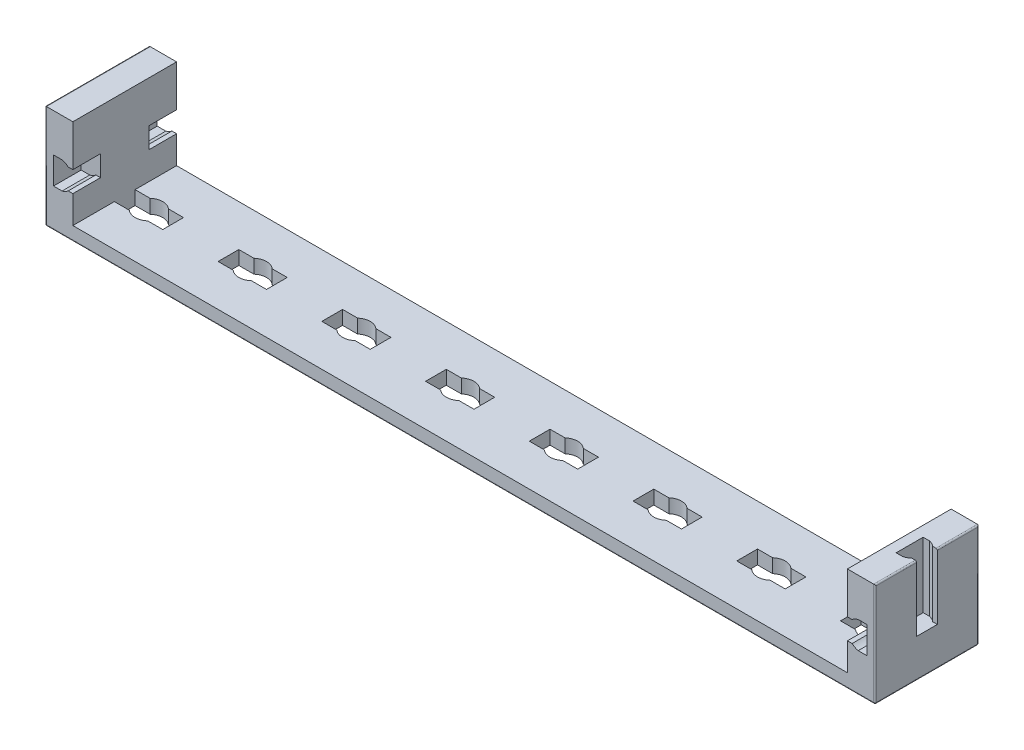
from build123d import *

# Parameters (mm, degrees)
SKETCH_1_W                 = 120
SKETCH_1_H                 = 15
EXTRUDE_1_DEPTH            = 2
SKETCH_2_W                 = 4
SKETCH_2_H                 = 15
EXTRUDE_2_DEPTH            = 13
CUT_EXTRUDE_1_REACH        = 63.849
PATTERN_LINEAR_1_COUNT     = 5
PATTERN_LINEAR_1_PITCH     = 15
PATTERN_LINEAR_1_COL_COUNT = 4
PATTERN_LINEAR_1_COL_PITCH = 15
CUT_EXTRUDE_2_DEPTH        = 4
MIRROR_2_COPY_1_DEPTH      = 4
CUT_EXTRUDE_3_DEPTH        = 9.45
EXTRUDE_3_DEPTH            = 15
CUT_EXTRUDE_4_DEPTH        = 15
FILLET_1_R                 = 0.2
FILLET_2_R                 = 0.1


with BuildPart() as part:
    # 草图1 → 凸台-拉伸1 (new body)
    with BuildSketch(Plane(origin=(0, 0, 0), x_dir=(1, 0, 0), z_dir=(0, 1, 0))):
        Rectangle(SKETCH_1_W, SKETCH_1_H)
    extrude(amount=EXTRUDE_1_DEPTH)

    # 草图2 → 凸台-拉伸2 (add)
    with BuildSketch(Plane(origin=(0, 2, 0), x_dir=(1, 0, 0), z_dir=(0, 1, 0))):
        with Locations((-58, 0)):
            Rectangle(SKETCH_2_W, SKETCH_2_H)
        with Locations((58, 0)):
            Rectangle(SKETCH_2_W, SKETCH_2_H)
    extrude(amount=EXTRUDE_2_DEPTH)

    # 草图3 → 切除-拉伸1 (cut, up to next)
    with BuildSketch(Plane(origin=(0, 2, 0), x_dir=(1, 0, 0), z_dir=(0, 1, 0)), mode=Mode.PRIVATE) as cut_extrude_1_sk1:
        with BuildLine():
            Line((-4, -1.5), (-4, 1.5))
            Line((-4, 1.5), (-6.177124344, 1.5))
            ThreePointArc((-6.177124344, 1.5), (-7.5, 2), (-8.822875656, 1.5))
            Line((-8.822875656, 1.5), (-11, 1.5))
            Line((-11, 1.5), (-11, -1.5))
            Line((-11, -1.5), (-8.822875656, -1.5))
            ThreePointArc((-8.822875656, -1.5), (-7.5, -2), (-6.177124344, -1.5))
            Line((-6.177124344, -1.5), (-4, -1.5))
        make_face()
    cut_extrude_1_tool1 = extrude(cut_extrude_1_sk1.sketch, amount=-CUT_EXTRUDE_1_REACH, mode=Mode.PRIVATE) & part.part
    cut_extrude_1 = cut_extrude_1_tool1.solids().sort_by_distance((-7.5, 2, 0))[0]
    add(cut_extrude_1, mode=Mode.SUBTRACT)

    # 阵列(线性)1: 切除-拉伸1 ×5
    with Locations(*[(i * PATTERN_LINEAR_1_PITCH, 0, 0) for i in range(1, PATTERN_LINEAR_1_COUNT)]):
        add(cut_extrude_1, mode=Mode.SUBTRACT)

    # 阵列(线性)1 col: 切除-拉伸1 ×4
    with Locations(*[(-i * PATTERN_LINEAR_1_COL_PITCH, 0, 0) for i in range(1, PATTERN_LINEAR_1_COL_COUNT)]):
        add(cut_extrude_1, mode=Mode.SUBTRACT)

    # 草图4 → 切除-拉伸2 (cut)
    with BuildSketch(Plane.XY.offset(7.5)):
        with BuildLine():
            Line((-56, 6), (-56, 9))
            Line((-56, 9), (-56.677124344, 9))
            ThreePointArc((-56.677124344, 9), (-57.088161527, 9.280042303), (-57.555590279, 9.45))
            Line((-57.555590279, 9.45), (-58.8, 9.45))
            Line((-58.8, 9.45), (-58.8, 5.55))
            Line((-58.8, 5.55), (-57.555590279, 5.55))
            ThreePointArc((-57.555590279, 5.55), (-57.088161527, 5.719957697), (-56.677124344, 6))
            Line((-56.677124344, 6), (-56, 6))
        make_face()
    cut_extrude_2 = extrude(amount=-CUT_EXTRUDE_2_DEPTH, mode=Mode.SUBTRACT)

    # 镜向1: 切除-拉伸2 across plane
    add(cut_extrude_2.mirror(Plane.XY), mode=Mode.SUBTRACT)

    # 镜向2: 切除-拉伸2 across plane
    add(cut_extrude_2.mirror(Plane(origin=(0, 0, 0), x_dir=(0, 0, 1), z_dir=(1, 0, 0))), mode=Mode.SUBTRACT)

    # 镜向2 copy 1 sketch → 镜向2 copy 1 (cut)
    with BuildSketch(Plane(origin=(0, 0, -7.5), x_dir=(-1, 0, 0), z_dir=(0, 0, -1))):
        with BuildLine():
            Line((-56, 6), (-56, 9))
            Line((-56, 9), (-56.677124344, 9))
            ThreePointArc((-56.677124344, 9), (-57.088161527, 9.280042303), (-57.555590279, 9.45))
            Line((-57.555590279, 9.45), (-58.8, 9.45))
            Line((-58.8, 9.45), (-58.8, 5.55))
            Line((-58.8, 5.55), (-57.555590279, 5.55))
            ThreePointArc((-57.555590279, 5.55), (-57.088161527, 5.719957697), (-56.677124344, 6))
            Line((-56.677124344, 6), (-56, 6))
        make_face()
    extrude(amount=-MIRROR_2_COPY_1_DEPTH, mode=Mode.SUBTRACT)

    # 草图5 → 切除-拉伸3 (cut)
    with BuildSketch(Plane(origin=(0, 15, 0), x_dir=(1, 0, 0), z_dir=(0, 1, 0))):
        with BuildLine():
            Line((60, -1.5), (60, 1.5))
            Line((60, 1.5), (59.322875656, 1.5))
            ThreePointArc((59.322875656, 1.5), (58.911838473, 1.780042303), (58.444409721, 1.95))
            Line((58.444409721, 1.95), (57.5, 1.95))
            Line((57.5, 1.95), (57.5, -1.95))
            Line((57.5, -1.95), (58.444409721, -1.95))
            ThreePointArc((58.444409721, -1.95), (58.911838473, -1.780042303), (59.322875656, -1.5))
            Line((59.322875656, -1.5), (60, -1.5))
        make_face()
    extrude(amount=-CUT_EXTRUDE_3_DEPTH, mode=Mode.SUBTRACT)

    # 草图6 → 凸台-拉伸3 (add)
    with BuildSketch(Plane(origin=(0, 15, 0), x_dir=(1, 0, 0), z_dir=(0, 1, 0))):
        with BuildLine():
            Line((-60, -1.5), (-60, 1.5))
            Line((-60, 1.5), (-60.677124344, 1.5))
            ThreePointArc((-60.677124344, 1.5), (-61.088161527, 1.780042303), (-61.555590279, 1.95))
            Line((-61.555590279, 1.95), (-62.5, 1.95))
            Line((-62.5, 1.95), (-62.5, -1.95))
            Line((-62.5, -1.95), (-61.555590279, -1.95))
            ThreePointArc((-61.555590279, -1.95), (-61.088161527, -1.780042303), (-60.677124344, -1.5))
            Line((-60.677124344, -1.5), (-60, -1.5))
        make_face()
    extrude(amount=-EXTRUDE_3_DEPTH)

    # 草图7 → 切除-拉伸4 (cut)
    with BuildSketch(Plane.XY.offset(7.5)):
        with BuildLine():
            Line((-62.5, 9.45), (-61.555590279, 9.45))
            ThreePointArc((-61.555590279, 9.45), (-61.088161527, 9.280042303), (-60.677124344, 9))
            Line((-60.677124344, 9), (-60, 9))
            Line((-60, 9), (-60, 15))
            Line((-60, 15), (-62.5, 15))
            Line((-62.5, 15), (-62.5, 9.45))
        make_face()
        with BuildLine():
            Line((-60, 0), (-60, 6))
            Line((-60, 6), (-60.677124344, 6))
            ThreePointArc((-60.677124344, 6), (-61.088161527, 5.719957697), (-61.555590279, 5.55))
            Line((-61.555590279, 5.55), (-62.5, 5.55))
            Line((-62.5, 5.55), (-62.5, 0))
            Line((-62.5, 0), (-60, 0))
        make_face()
    extrude(amount=-CUT_EXTRUDE_4_DEPTH, mode=Mode.SUBTRACT)

    # 圆角1
    fillet_1_edges = [part.edges().sort_by_distance(p)[0] for p in [
        (-60, 15, 0),
        (60, 15, 4.5),
        (60, 15, -4.5),
        (60, 0, 0),
        (0, 0, 7.5),
        (-60, 0, 0),
        (0, 0, -7.5),
        (60, 7.5, -7.5),
        (60, 7.5, 7.5),
        (-60, 7.5, 7.5),
        (-60, 7.5, -7.5),
    ]]
    fillet(fillet_1_edges, radius=FILLET_1_R)

    # 圆角2
    fillet_2_edges = [part.edges().sort_by_distance(p)[0] for p in [
        (-62.5, 7.5, -1.95),
        (-62.5, 7.5, 1.95),
        (-62.5, 5.55, 0),
        (-62.5, 9.45, 0),
    ]]
    fillet(fillet_2_edges, radius=FILLET_2_R)


solid = part.part
